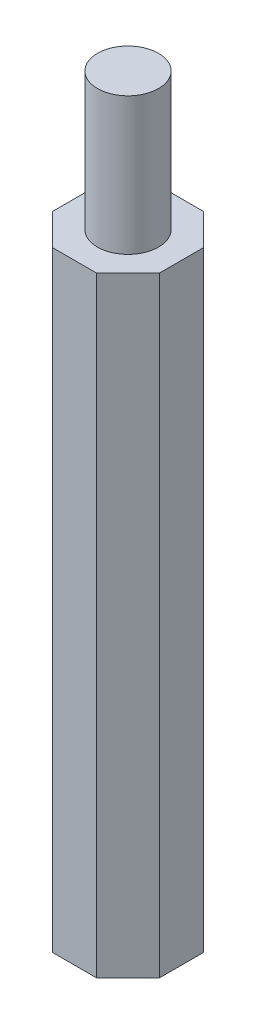
from build123d import *

# Parameters (mm, degrees)
EXTRUSION1_DEPTH        = 20
ESQUISSE2_R             = 2
EXTRUSION2_DEPTH        = 9
ESQUISSE3_R             = 2
ENL_V_MAT_EXTRU_1_DEPTH = 9


with BuildPart() as part:
    # Esquisse1 → Extrusion1 (new, symmetric)
    with BuildSketch(Plane(origin=(0, 0, 0), x_dir=(1, 0, 0), z_dir=(0, 1, 0))):
        Polygon((-1.449747468, 3.5), (1.449747468, 3.5), (3.5, 1.449747468), (3.5, -1.449747468), (1.449747468, -3.5), (-1.449747468, -3.5), (-3.5, -1.449747468), (-3.5, 1.449747468), align=None)
    extrude(amount=EXTRUSION1_DEPTH, both=True)

    # Esquisse2 → Extrusion2 (add)
    with BuildSketch(Plane(origin=(0, 20, 0), x_dir=(1, 0, 0), z_dir=(0, 1, 0))):
        with Locations(Location((0, 0, 0), (0, 0, 270))):
            Circle(ESQUISSE2_R)
    extrude(amount=EXTRUSION2_DEPTH)

    # Esquisse3 → Enlèv. mat.-Extru.1 (cut)
    with BuildSketch(Plane.XZ.offset(20)):
        with Locations(Location((0, 0, 0), (0, 0, 90))):
            Circle(ESQUISSE3_R)
    extrude(amount=-ENL_V_MAT_EXTRU_1_DEPTH, mode=Mode.SUBTRACT)


solid = part.part
